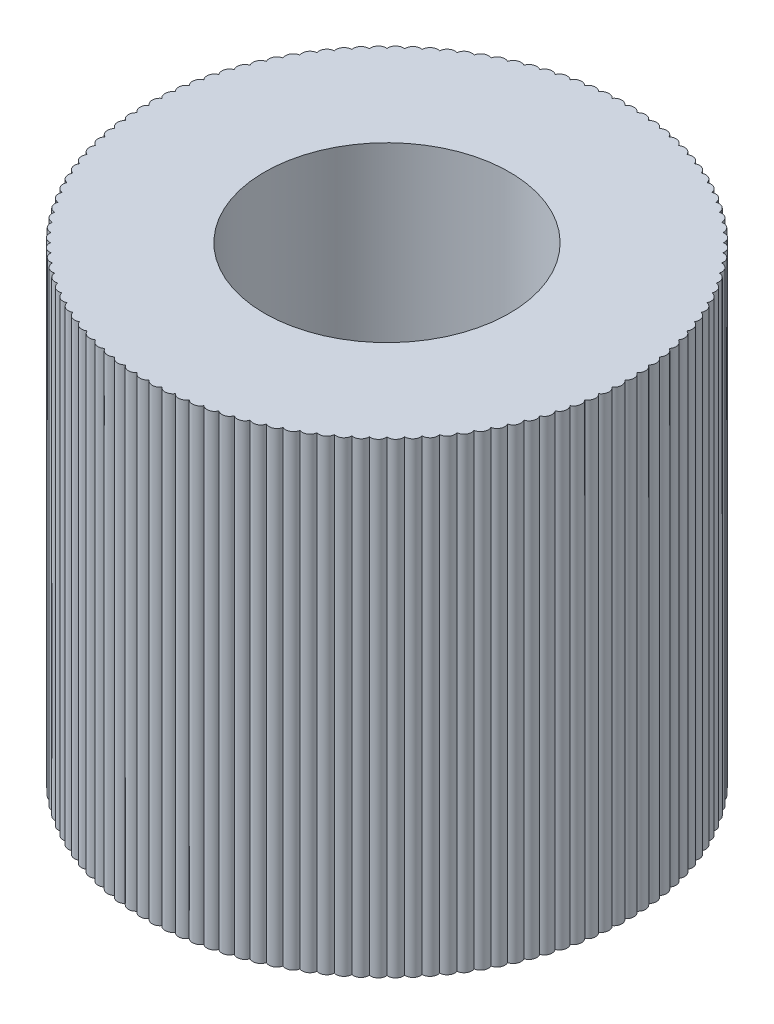
from build123d import *

# Parameters (mm, degrees)
SKETCH1_R           = 2.625
BOSS_EXTRUDE1_DEPTH = 10


with BuildPart() as part:
    # Sketch1 → Boss-Extrude1 (new body)
    with BuildSketch(Plane(origin=(0, 0, 0), x_dir=(1, 0, 0), z_dir=(0, 1, 0))):
        with BuildLine():
            ThreePointArc((0, 5.1), (-0.135223836, 5.16398997), (-0.266913377, 5.093010627))
            ThreePointArc((-0.266913377, 5.093010627), (-0.40530087, 5.149835832), (-0.533095163, 5.072061666))
            ThreePointArc((-0.533095163, 5.072061666), (-0.674267002, 5.121566353), (-0.797815772, 5.037210537))
            ThreePointArc((-0.797815772, 5.037210537), (-0.941385015, 5.079259016), (-1.060349623, 4.988552764))
            ThreePointArc((-1.060349623, 4.988552764), (-1.205922757, 5.023029783), (-1.31997713, 4.926221714))
            ThreePointArc((-1.31997713, 4.926221714), (-1.467155149, 4.953032774), (-1.575986671, 4.850388233))
            ThreePointArc((-1.575986671, 4.850388233), (-1.72436617, 4.869459847), (-1.827676543, 4.761260175))
            ThreePointArc((-1.827676543, 4.761260175), (-1.976850824, 4.772540069), (-2.07435688, 4.659081834))
            ThreePointArc((-2.07435688, 4.659081834), (-2.223917067, 4.662539091), (-2.315351549, 4.544133273))
            ThreePointArc((-2.315351549, 4.544133273), (-2.464887707, 4.539758417), (-2.55, 4.416729559))
            ThreePointArc((-2.55, 4.416729559), (-2.699102262, 4.404534581), (-2.777659079, 4.277219897))
            ThreePointArc((-2.777659079, 4.277219897), (-2.925918766, 4.257238221), (-2.997704787, 4.125986671))
            ThreePointArc((-2.997704787, 4.125986671), (-3.144715529, 4.098273068), (-3.209533994, 3.963444403))
            ThreePointArc((-3.209533994, 3.963444403), (-3.354892845, 3.928074832), (-3.412566092, 3.79003861))
            ThreePointArc((-3.412566092, 3.79003861), (-3.555874634, 3.747110017), (-3.606244584, 3.606244584))
            ThreePointArc((-3.606244584, 3.606244584), (-3.747110017, 3.555874634), (-3.79003861, 3.412566092))
            ThreePointArc((-3.79003861, 3.412566092), (-3.928074832, 3.354892845), (-3.963444403, 3.209533994))
            ThreePointArc((-3.963444403, 3.209533994), (-4.098273068, 3.144715529), (-4.125986671, 2.997704787))
            ThreePointArc((-4.125986671, 2.997704787), (-4.257238221, 2.925918766), (-4.277219897, 2.777659079))
            ThreePointArc((-4.277219897, 2.777659079), (-4.404534581, 2.699102262), (-4.416729559, 2.55))
            ThreePointArc((-4.416729559, 2.55), (-4.539758417, 2.464887707), (-4.544133273, 2.315351549))
            ThreePointArc((-4.544133273, 2.315351549), (-4.662539091, 2.223917067), (-4.659081834, 2.07435688))
            ThreePointArc((-4.659081834, 2.07435688), (-4.772540069, 1.976850824), (-4.761260175, 1.827676543))
            ThreePointArc((-4.761260175, 1.827676543), (-4.869459847, 1.72436617), (-4.850388233, 1.575986671))
            ThreePointArc((-4.850388233, 1.575986671), (-4.953032774, 1.467155149), (-4.926221714, 1.31997713))
            ThreePointArc((-4.926221714, 1.31997713), (-5.023029783, 1.205922757), (-4.988552764, 1.060349623))
            ThreePointArc((-4.988552764, 1.060349623), (-5.079259016, 0.941385015), (-5.037210537, 0.797815772))
            ThreePointArc((-5.037210537, 0.797815772), (-5.121566353, 0.674267002), (-5.072061666, 0.533095163))
            ThreePointArc((-5.072061666, 0.533095163), (-5.149835832, 0.40530087), (-5.093010627, 0.266913377))
            ThreePointArc((-5.093010627, 0.266913377), (-5.16398997, 0.135223836), (-5.1, 0))
            ThreePointArc((-5.1, 0), (-5.16398997, -0.135223836), (-5.093010627, -0.266913377))
            ThreePointArc((-5.093010627, -0.266913377), (-5.149835832, -0.40530087), (-5.072061666, -0.533095163))
            ThreePointArc((-5.072061666, -0.533095163), (-5.121566353, -0.674267002), (-5.037210537, -0.797815772))
            ThreePointArc((-5.037210537, -0.797815772), (-5.079259016, -0.941385015), (-4.988552764, -1.060349623))
            ThreePointArc((-4.988552764, -1.060349623), (-5.023029783, -1.205922757), (-4.926221714, -1.31997713))
            ThreePointArc((-4.926221714, -1.31997713), (-4.953032774, -1.467155149), (-4.850388233, -1.575986671))
            ThreePointArc((-4.850388233, -1.575986671), (-4.869459847, -1.72436617), (-4.761260175, -1.827676543))
            ThreePointArc((-4.761260175, -1.827676543), (-4.772540069, -1.976850824), (-4.659081834, -2.07435688))
            ThreePointArc((-4.659081834, -2.07435688), (-4.662539091, -2.223917067), (-4.544133273, -2.315351549))
            ThreePointArc((-4.544133273, -2.315351549), (-4.539758417, -2.464887707), (-4.416729559, -2.55))
            ThreePointArc((-4.416729559, -2.55), (-4.404534581, -2.699102262), (-4.277219897, -2.777659079))
            ThreePointArc((-4.277219897, -2.777659079), (-4.257238221, -2.925918766), (-4.125986671, -2.997704787))
            ThreePointArc((-4.125986671, -2.997704787), (-4.098273068, -3.144715529), (-3.963444403, -3.209533994))
            ThreePointArc((-3.963444403, -3.209533994), (-3.928074832, -3.354892845), (-3.79003861, -3.412566092))
            ThreePointArc((-3.79003861, -3.412566092), (-3.747110017, -3.555874634), (-3.606244584, -3.606244584))
            ThreePointArc((-3.606244584, -3.606244584), (-3.555874634, -3.747110017), (-3.412566092, -3.79003861))
            ThreePointArc((-3.412566092, -3.79003861), (-3.354892845, -3.928074832), (-3.209533994, -3.963444403))
            ThreePointArc((-3.209533994, -3.963444403), (-3.144715529, -4.098273068), (-2.997704787, -4.125986671))
            ThreePointArc((-2.997704787, -4.125986671), (-2.925918766, -4.257238221), (-2.777659079, -4.277219897))
            ThreePointArc((-2.777659079, -4.277219897), (-2.699102262, -4.404534581), (-2.55, -4.416729559))
            ThreePointArc((-2.55, -4.416729559), (-2.464887707, -4.539758417), (-2.315351549, -4.544133273))
            ThreePointArc((-2.315351549, -4.544133273), (-2.223917067, -4.662539091), (-2.07435688, -4.659081834))
            ThreePointArc((-2.07435688, -4.659081834), (-1.976850824, -4.772540069), (-1.827676543, -4.761260175))
            ThreePointArc((-1.827676543, -4.761260175), (-1.72436617, -4.869459847), (-1.575986671, -4.850388233))
            ThreePointArc((-1.575986671, -4.850388233), (-1.467155149, -4.953032774), (-1.31997713, -4.926221714))
            ThreePointArc((-1.31997713, -4.926221714), (-1.205922757, -5.023029783), (-1.060349623, -4.988552764))
            ThreePointArc((-1.060349623, -4.988552764), (-0.941385015, -5.079259016), (-0.797815772, -5.037210537))
            ThreePointArc((-0.797815772, -5.037210537), (-0.674267002, -5.121566353), (-0.533095163, -5.072061666))
            ThreePointArc((-0.533095163, -5.072061666), (-0.40530087, -5.149835832), (-0.266913377, -5.093010627))
            ThreePointArc((-0.266913377, -5.093010627), (-0.135223836, -5.16398997), (0, -5.1))
            ThreePointArc((0, -5.1), (0.135223836, -5.16398997), (0.266913377, -5.093010627))
            ThreePointArc((0.266913377, -5.093010627), (0.40530087, -5.149835832), (0.533095163, -5.072061666))
            ThreePointArc((0.533095163, -5.072061666), (0.674267002, -5.121566353), (0.797815772, -5.037210537))
            ThreePointArc((0.797815772, -5.037210537), (0.941385015, -5.079259016), (1.060349623, -4.988552764))
            ThreePointArc((1.060349623, -4.988552764), (1.205922757, -5.023029783), (1.31997713, -4.926221714))
            ThreePointArc((1.31997713, -4.926221714), (1.467155149, -4.953032774), (1.575986671, -4.850388233))
            ThreePointArc((1.575986671, -4.850388233), (1.72436617, -4.869459847), (1.827676543, -4.761260175))
            ThreePointArc((1.827676543, -4.761260175), (1.976850824, -4.772540069), (2.07435688, -4.659081834))
            ThreePointArc((2.07435688, -4.659081834), (2.223917067, -4.662539091), (2.315351549, -4.544133273))
            ThreePointArc((2.315351549, -4.544133273), (2.464887707, -4.539758417), (2.55, -4.416729559))
            ThreePointArc((2.55, -4.416729559), (2.699102262, -4.404534581), (2.777659079, -4.277219897))
            ThreePointArc((2.777659079, -4.277219897), (2.925918766, -4.257238221), (2.997704787, -4.125986671))
            ThreePointArc((2.997704787, -4.125986671), (3.144715529, -4.098273068), (3.209533994, -3.963444403))
            ThreePointArc((3.209533994, -3.963444403), (3.354892845, -3.928074832), (3.412566092, -3.79003861))
            ThreePointArc((3.412566092, -3.79003861), (3.555874634, -3.747110017), (3.606244584, -3.606244584))
            ThreePointArc((3.606244584, -3.606244584), (3.747110017, -3.555874634), (3.79003861, -3.412566092))
            ThreePointArc((3.79003861, -3.412566092), (3.928074832, -3.354892845), (3.963444403, -3.209533994))
            ThreePointArc((3.963444403, -3.209533994), (4.098273068, -3.144715529), (4.125986671, -2.997704787))
            ThreePointArc((4.125986671, -2.997704787), (4.257238221, -2.925918766), (4.277219897, -2.777659079))
            ThreePointArc((4.277219897, -2.777659079), (4.404534581, -2.699102262), (4.416729559, -2.55))
            ThreePointArc((4.416729559, -2.55), (4.539758417, -2.464887707), (4.544133273, -2.315351549))
            ThreePointArc((4.544133273, -2.315351549), (4.662539091, -2.223917067), (4.659081834, -2.07435688))
            ThreePointArc((4.659081834, -2.07435688), (4.772540069, -1.976850824), (4.761260175, -1.827676543))
            ThreePointArc((4.761260175, -1.827676543), (4.869459847, -1.72436617), (4.850388233, -1.575986671))
            ThreePointArc((4.850388233, -1.575986671), (4.953032774, -1.467155149), (4.926221714, -1.31997713))
            ThreePointArc((4.926221714, -1.31997713), (5.023029783, -1.205922757), (4.988552764, -1.060349623))
            ThreePointArc((4.988552764, -1.060349623), (5.079259016, -0.941385015), (5.037210537, -0.797815772))
            ThreePointArc((5.037210537, -0.797815772), (5.121566353, -0.674267002), (5.072061666, -0.533095163))
            ThreePointArc((5.072061666, -0.533095163), (5.149835832, -0.40530087), (5.093010627, -0.266913377))
            ThreePointArc((5.093010627, -0.266913377), (5.16398997, -0.135223836), (5.1, 0))
            ThreePointArc((5.1, 0), (5.16398997, 0.135223836), (5.093010627, 0.266913377))
            ThreePointArc((5.093010627, 0.266913377), (5.149835832, 0.40530087), (5.072061666, 0.533095163))
            ThreePointArc((5.072061666, 0.533095163), (5.121566353, 0.674267002), (5.037210537, 0.797815772))
            ThreePointArc((5.037210537, 0.797815772), (5.079259016, 0.941385015), (4.988552764, 1.060349623))
            ThreePointArc((4.988552764, 1.060349623), (5.023029783, 1.205922757), (4.926221714, 1.31997713))
            ThreePointArc((4.926221714, 1.31997713), (4.953032774, 1.467155149), (4.850388233, 1.575986671))
            ThreePointArc((4.850388233, 1.575986671), (4.869459847, 1.72436617), (4.761260175, 1.827676543))
            ThreePointArc((4.761260175, 1.827676543), (4.772540069, 1.976850824), (4.659081834, 2.07435688))
            ThreePointArc((4.659081834, 2.07435688), (4.662539091, 2.223917067), (4.544133273, 2.315351549))
            ThreePointArc((4.544133273, 2.315351549), (4.539758417, 2.464887707), (4.416729559, 2.55))
            ThreePointArc((4.416729559, 2.55), (4.404534581, 2.699102262), (4.277219897, 2.777659079))
            ThreePointArc((4.277219897, 2.777659079), (4.257238221, 2.925918766), (4.125986671, 2.997704787))
            ThreePointArc((4.125986671, 2.997704787), (4.098273068, 3.144715529), (3.963444403, 3.209533994))
            ThreePointArc((3.963444403, 3.209533994), (3.928074832, 3.354892845), (3.79003861, 3.412566092))
            ThreePointArc((3.79003861, 3.412566092), (3.747110017, 3.555874634), (3.606244584, 3.606244584))
            ThreePointArc((3.606244584, 3.606244584), (3.555874634, 3.747110017), (3.412566092, 3.79003861))
            ThreePointArc((3.412566092, 3.79003861), (3.354892845, 3.928074832), (3.209533994, 3.963444403))
            ThreePointArc((3.209533994, 3.963444403), (3.144715529, 4.098273068), (2.997704787, 4.125986671))
            ThreePointArc((2.997704787, 4.125986671), (2.925918766, 4.257238221), (2.777659079, 4.277219897))
            ThreePointArc((2.777659079, 4.277219897), (2.699102262, 4.404534581), (2.55, 4.416729559))
            ThreePointArc((2.55, 4.416729559), (2.464887707, 4.539758417), (2.315351549, 4.544133273))
            ThreePointArc((2.315351549, 4.544133273), (2.223917067, 4.662539091), (2.07435688, 4.659081834))
            ThreePointArc((2.07435688, 4.659081834), (1.976850824, 4.772540069), (1.827676543, 4.761260175))
            ThreePointArc((1.827676543, 4.761260175), (1.72436617, 4.869459847), (1.575986671, 4.850388233))
            ThreePointArc((1.575986671, 4.850388233), (1.467155149, 4.953032774), (1.31997713, 4.926221714))
            ThreePointArc((1.31997713, 4.926221714), (1.205922757, 5.023029783), (1.060349623, 4.988552764))
            ThreePointArc((1.060349623, 4.988552764), (0.941385015, 5.079259016), (0.797815772, 5.037210537))
            ThreePointArc((0.797815772, 5.037210537), (0.674267002, 5.121566353), (0.533095163, 5.072061666))
            ThreePointArc((0.533095163, 5.072061666), (0.40530087, 5.149835832), (0.266913377, 5.093010627))
            ThreePointArc((0.266913377, 5.093010627), (0.135223836, 5.16398997), (0, 5.1))
        make_face()
        with Locations(Location((0, 0, 0), (0, 0, 270))):
            Circle(SKETCH1_R, mode=Mode.SUBTRACT)
    extrude(amount=BOSS_EXTRUDE1_DEPTH)


solid = part.part
